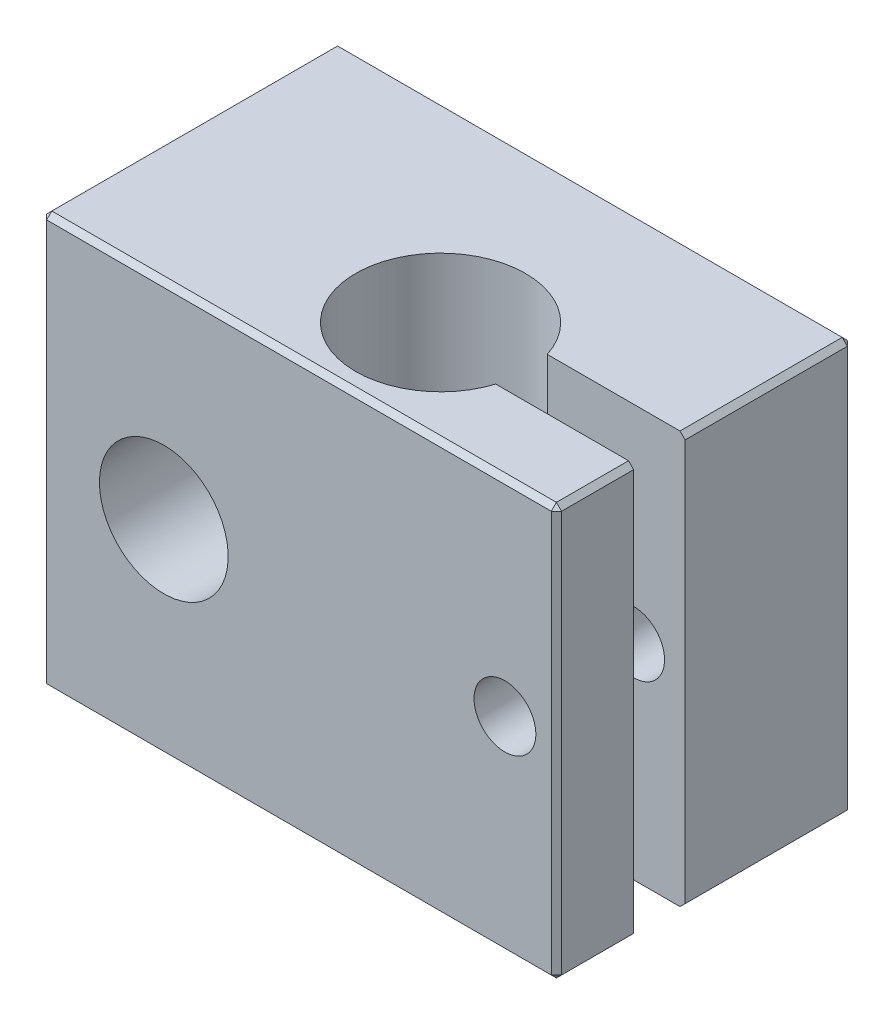
from build123d import *

# Parameters (mm, degrees)
SKETCH_1_W                    = 20
SKETCH_1_H                    = 16
EXTRUDE_1_DEPTH               = 11.5
CUT_EXTRUDE_1_DEPTH           = 25.916109247
SKETCH_3_W                    = 3.3
SKETCH_3_H                    = 16
HOLE_WIZARD_5_0_5_1_D         = 5
SKETCH_6_W                    = 0.8
SKETCH_6_H                    = 3
HOLE_WIZARD_2_4_2_4_1_D       = 2.4
HOLE_WIZARD_2_4_2_4_1_DEPTH   = 11.5
HOLE_WIZARD_2_05_2_05_1_D     = 2.05
HOLE_WIZARD_2_05_2_05_1_DEPTH = 4.5
HOLE_WIZARD_2_05_2_05_1_TIP   = 0.615882135
M2X0_41_D                     = 1
M2X0_41_DEPTH                 = 4.5
M2X0_41_CBORE_D               = 2
M2X0_41_CBORE_DEPTH           = 2
CHAMFER_1_SIZE                = 0.2


with BuildPart() as part:
    # Эскиз1 → Бобышка-Вытянуть1 (new body)
    with BuildSketch(Plane(origin=(0, 0, 0), x_dir=(-1, 0, 0), z_dir=(0, 0, -1))):
        with Locations((-5.25, 0)):
            Rectangle(SKETCH_1_W, SKETCH_1_H)
    extrude(amount=-EXTRUDE_1_DEPTH)

    # Эскиз2 → Вырез-Вытянуть1 (cut, through all)
    with BuildSketch(Plane(origin=(0, 8, 0), x_dir=(-1, 0, 0), z_dir=(0, 1, 0))):
        with BuildLine():
            Line((-15.25, 8.5), (-15.25, 6.5))
            Line((-15.25, 6.5), (-9.894837039, 6.5))
            ThreePointArc((-9.894837039, 6.5), (-10.05, 7.5), (-9.894837039, 8.5))
            Line((-9.894837039, 8.5), (-15.25, 8.5))
        make_face()
    extrude(amount=-CUT_EXTRUDE_1_DEPTH, mode=Mode.SUBTRACT)

    # Эскиз3 → Вырез-Повернуть1 (revolve, cut)
    with BuildSketch(Plane.XY.offset(7.5)):
        with Locations((8.4, 0)):
            Rectangle(SKETCH_3_W, SKETCH_3_H)
    revolve(axis=Axis((6.75, 8, 7.5), (0, -1, 0)), mode=Mode.SUBTRACT)

    # Диаметр отверстия Ø5.0 (5)1 (through all)
    with Locations(Plane(origin=(0, 0, 0), x_dir=(-1, 0, 0), z_dir=(0, 0, -1))):
        with Locations((0, 0)):
            Hole(HOLE_WIZARD_5_0_5_1_D / 2)

    # Эскиз6 → Диаметр отверстия Ø1.6 (1.6)1 (revolve, cut)
    with BuildSketch(Plane(origin=(13.25, 0, 8.5), x_dir=(0, 1, 0), z_dir=(1, 0, 0))):
        with Locations((0.4, 1.5)):
            Rectangle(SKETCH_6_W, SKETCH_6_H)
    revolve(axis=Axis((13.25, 0, 2.15), (0, 0, 1)), mode=Mode.SUBTRACT)

    # Диаметр отверстия Ø2.4 (2.4)1
    with Locations(Plane(origin=(0, 0, 0), x_dir=(-1, 0, 0), z_dir=(0, 0, -1))):
        with Locations((-13.25, 0)):
            Hole(HOLE_WIZARD_2_4_2_4_1_D / 2, depth=HOLE_WIZARD_2_4_2_4_1_DEPTH)

    # Диаметр отверстия Ø2.05 (2.05)1
    with Locations(Plane(origin=(0, -8, 0), x_dir=(-1, 0, 0), z_dir=(0, -1, 0))):
        with Locations((1.25, -6.5)):
            Hole(HOLE_WIZARD_2_05_2_05_1_D / 2, depth=HOLE_WIZARD_2_05_2_05_1_DEPTH)
            with Locations((0, 0, -(HOLE_WIZARD_2_05_2_05_1_DEPTH + HOLE_WIZARD_2_05_2_05_1_TIP / 2))):  # 118° drill point
                Cone(0, HOLE_WIZARD_2_05_2_05_1_D / 2, HOLE_WIZARD_2_05_2_05_1_TIP, mode=Mode.SUBTRACT)

    # Отверстие обработанное метчиком M2x0.41
    with Locations(Plane(origin=(0, -8, 0), x_dir=(-1, 0, 0), z_dir=(0, -1, 0))):
        with Locations((2.25, -9)):
            CounterBoreHole(M2X0_41_D / 2, M2X0_41_CBORE_D / 2, M2X0_41_CBORE_DEPTH, depth=M2X0_41_DEPTH)

    # Фаска1
    chamfer_1_edges = [part.edges().sort_by_distance(p)[0] for p in [
        (-4.75, 0, 11.5),
        (5.25, 8, 11.5),
        (15.25, -8, 3.25),
        (15.25, 8, 3.25),
        (15.25, 0, 11.5),
        (5.25, 8, 0),
        (-4.75, 0, 0),
        (5.25, -8, 0),
        (15.25, 0, 0),
        (5.25, -8, 11.5),
        (15.25, 8, 10),
        (-4.75, 8, 5.75),
        (-4.75, -8, 5.75),
        (15.25, -8, 10),
    ]]
    chamfer(chamfer_1_edges, length=CHAMFER_1_SIZE)


solid = part.part
